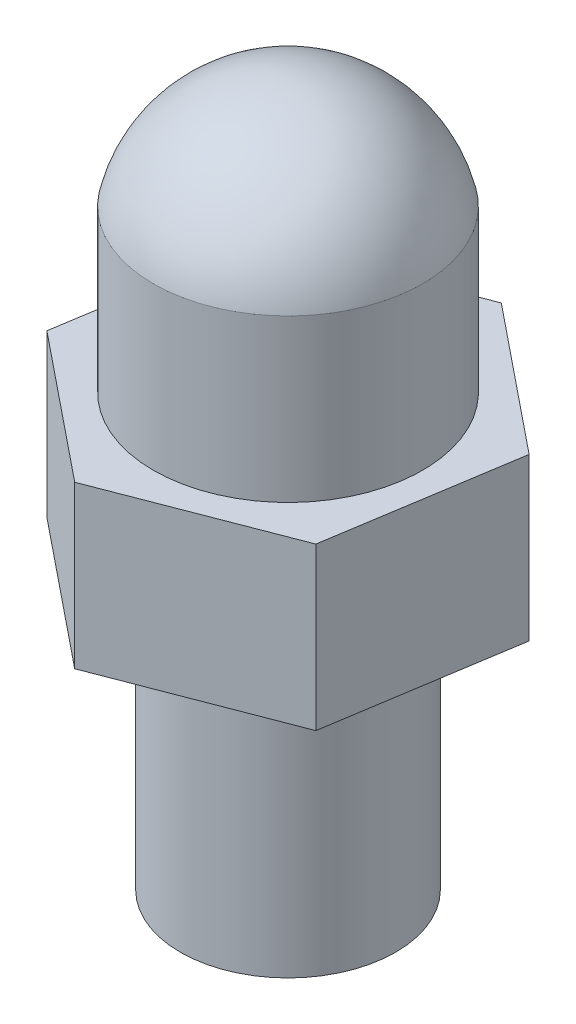
from build123d import *

# Parameters (mm, degrees)
IZIM1_R                     = 2
Y_KSEKLIK_EKSTR_ZYON1_DEPTH = 5
Y_KSEKLIK_EKSTR_ZYON2_DEPTH = 3
IZIM3_R                     = 2.5
Y_KSEKLIK_EKSTR_ZYON3_DEPTH = 3
KUBBE1_FACE_RADIUS          = 2.5
KUBBE1_HEIGHT               = 2


with BuildPart() as part:
    # Çizim1 → Yükseklik-Ekstrüzyon1 (new body)
    with BuildSketch(Plane(origin=(0, 0, 0), x_dir=(1, 0, 0), z_dir=(0, 1, 0))):
        with Locations(Location((0, 0, 0), (0, 0, 270))):
            Circle(IZIM1_R)
    extrude(amount=Y_KSEKLIK_EKSTR_ZYON1_DEPTH)

    # Çizim2 → Yükseklik-Ekstrüzyon2 (add)
    with BuildSketch(Plane(origin=(0, 5, 0), x_dir=(1, 0, 0), z_dir=(0, 1, 0))):
        Polygon((2.694173307, -2.177482536), (3.232841846, 1.244481258), (0.538668539, 3.421963794), (-2.694173307, 2.177482536), (-3.232841846, -1.244481258), (-0.538668539, -3.421963794), align=None)
    extrude(amount=Y_KSEKLIK_EKSTR_ZYON2_DEPTH)

    # Çizim3 → Yükseklik-Ekstrüzyon3 (add)
    with BuildSketch(Plane(origin=(0, 8, 0), x_dir=(1, 0, 0), z_dir=(0, 1, 0))):
        with Locations(Location((0, 0, 0), (0, 0, 270))):
            Circle(IZIM3_R)
    extrude(amount=Y_KSEKLIK_EKSTR_ZYON3_DEPTH)

    # Kubbe1: a dome of height H over a round flat face of radius A is a cap of a sphere of radius (A * A + H * H) / (2 * H)
    kubbe1_r = (KUBBE1_FACE_RADIUS * KUBBE1_FACE_RADIUS + KUBBE1_HEIGHT * KUBBE1_HEIGHT) / (2 * KUBBE1_HEIGHT)
    kubbe1_base = Plane((0, 11, 0), z_dir=(0, 1, 0))
    with Locations(kubbe1_base.offset(KUBBE1_HEIGHT - kubbe1_r)):
        kubbe1_ball = Sphere(kubbe1_r, mode=Mode.PRIVATE)
    add(split(kubbe1_ball, bisect_by=kubbe1_base, keep=Keep.TOP, mode=Mode.PRIVATE))


solid = part.part
